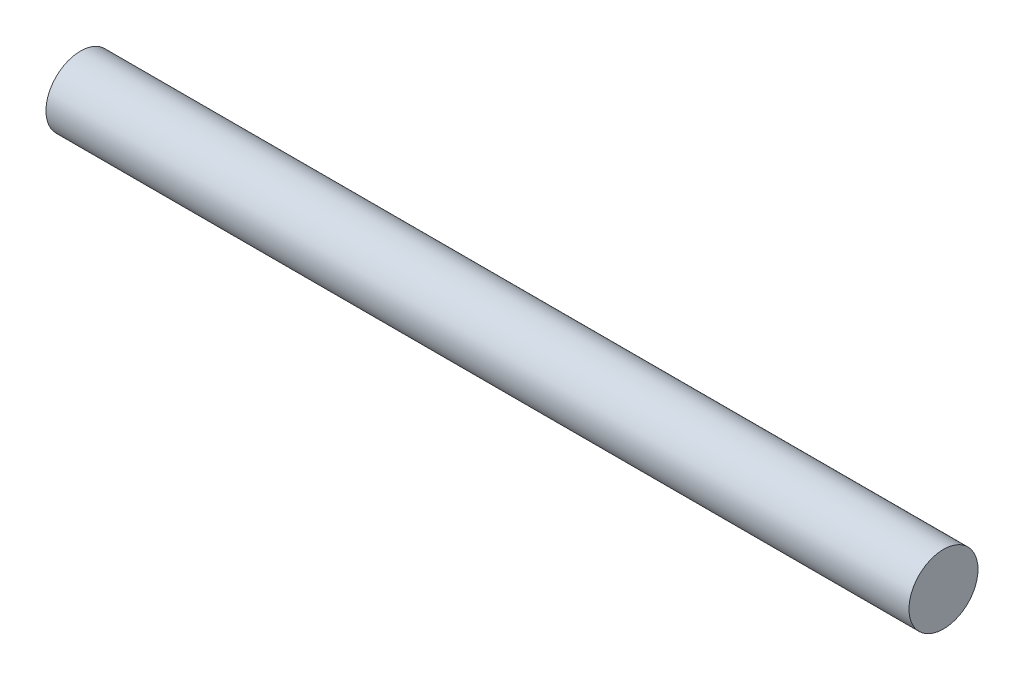
from build123d import *

# Parameters (mm, degrees)
SKETCH1_R           = 2.88
BOSS_EXTRUDE1_DEPTH = 72


with BuildPart() as part:
    # Sketch1 → Boss-Extrude1 (new body)
    with BuildSketch(Plane(origin=(0, 0, 0), x_dir=(0, 0, -1), z_dir=(1, 0, 0))):
        Circle(SKETCH1_R)
    extrude(amount=BOSS_EXTRUDE1_DEPTH)


solid = part.part
